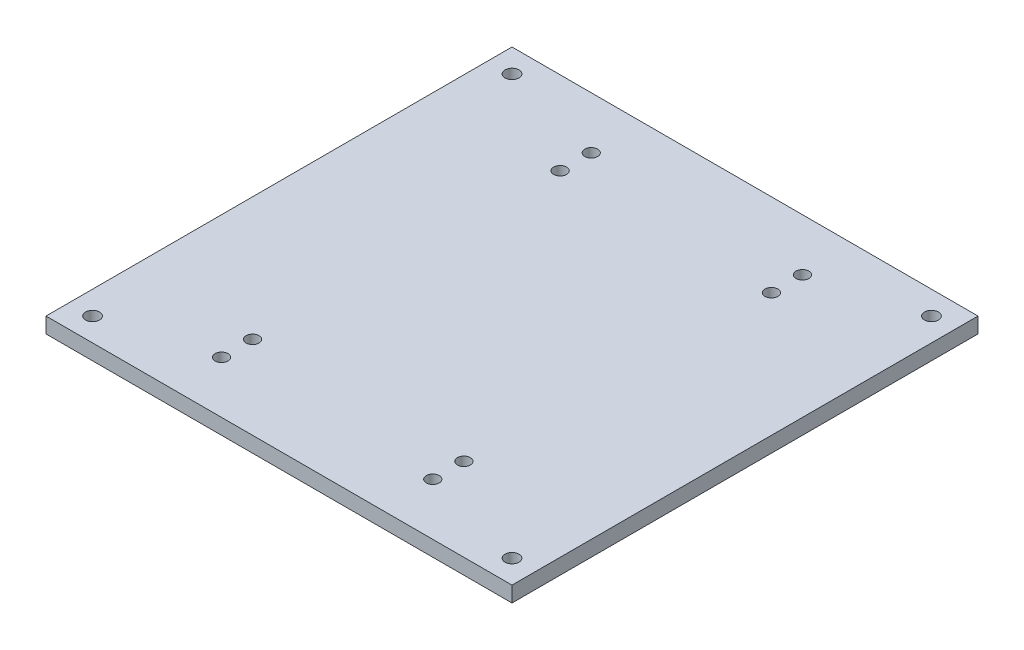
from build123d import *

# Parameters (mm, degrees)
SKETCH1_W                           = 300
SKETCH1_H                           = 300
BOSS_EXTRUDE1_DEPTH                 = 10
TAPPED_HOLE_FOR_M8X1_25_HELICOIL1_D = 8.3
M8_CLEARANCE_HOLE2_D                = 9


with BuildPart() as part:
    # Sketch1 → Boss-Extrude1 (new body)
    with BuildSketch(Plane(origin=(0, 0, 0), x_dir=(1, 0, 0), z_dir=(0, 1, 0))):
        Rectangle(SKETCH1_W, SKETCH1_H)
    extrude(amount=BOSS_EXTRUDE1_DEPTH)

    # Tapped Hole for M8x1.25 Helicoil1 (through all)
    with Locations(Plane(origin=(0, 10, 0), x_dir=(1, 0, 0), z_dir=(0, 1, 0))):
        with Locations((70.5, 116.5), (70.5, 96.5), (65.5, -96.5), (65.5, -116.5), (-65.5, 116.5), (-65.5, 96.5), (-70.5, -96.5), (-70.5, -116.5)):
            Hole(TAPPED_HOLE_FOR_M8X1_25_HELICOIL1_D / 2)

    # M8 Clearance Hole2 (through all)
    with Locations(Plane(origin=(0, 10, 0), x_dir=(1, 0, 0), z_dir=(0, 1, 0))):
        with Locations((-135, -135), (-135, 135), (135, 135), (135, -135)):
            Hole(M8_CLEARANCE_HOLE2_D / 2)


solid = part.part
